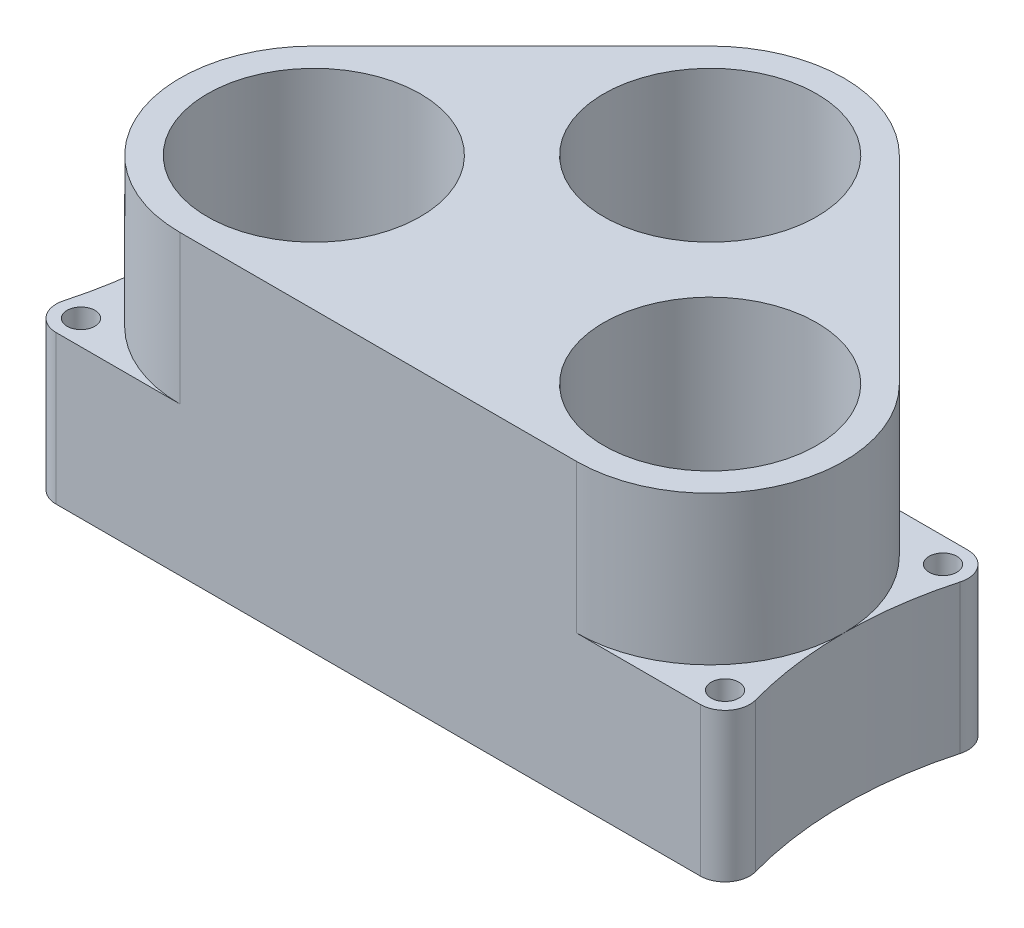
from build123d import *

# Parameters (mm, degrees)
SKETCH1_R           = 27.305
BOSS_EXTRUDE1_DEPTH = 76.2
SKETCH1_3_R         = 3.556
BOSS_EXTRUDE2_DEPTH = 38.1


with BuildPart() as part:
    # Sketch1 → Boss-Extrude1 (new body)
    with BuildSketch(Plane(origin=(0, 0, 0), x_dir=(1, 0, 0), z_dir=(0, 1, 0))):
        with BuildLine():
            Line((26.553308473, 75.046691527), (-24.246691527, 24.246691527))
            ThreePointArc((-24.246691527, 24.246691527), (-31.67982917, -13.122214896), (0, -34.29))
            Line((0, -34.29), (101.6, -34.29))
            ThreePointArc((101.6, -34.29), (133.27982917, -13.122214896), (125.846691527, 24.246691527))
            Line((125.846691527, 24.246691527), (75.046691527, 75.046691527))
            ThreePointArc((75.046691527, 75.046691527), (50.8, 85.09), (26.553308473, 75.046691527))
        make_face()
        with Locations(Location((101.6, 0, 0), (0, 0, 90))):
            Circle(SKETCH1_R, mode=Mode.SUBTRACT)
        with Locations(Location((0, 0, 0), (0, 0, 90))):
            Circle(SKETCH1_R, mode=Mode.SUBTRACT)
        with Locations(Location((50.8, 50.8, 0), (0, 0, 90))):
            Circle(SKETCH1_R, mode=Mode.SUBTRACT)
    extrude(amount=BOSS_EXTRUDE1_DEPTH)

    # Sketch1<3> → Boss-Extrude2 (add)
    # profile 1 of 4: a face of its own
    with BuildSketch(Plane(origin=(0, 0, 0), x_dir=(1, 0, 0), z_dir=(0, 1, 0))):
        with BuildLine():
            Line((-24.246691527, 24.246691527), (-14.203383054, 34.29))
            Line((-14.203383054, 34.29), (-31.75, 34.29))
            ThreePointArc((-31.75, 34.29), (-36.805629933, 31.782278749), (-37.868154158, 26.23979716))
            ThreePointArc((-37.868154158, 26.23979716), (-35.188658815, 13.241319251), (-34.29, -3e-09))
            ThreePointArc((-34.29, -3e-09), (-31.67982917, 13.122214895), (-24.246691527, 24.246691527))
        make_face()
        with Locations(Location((-31.75, 27.94, 0), (0, 0, 90))):
            Circle(SKETCH1_3_R, mode=Mode.SUBTRACT)
    # profile 2 of 4: a face of its own
    with BuildSketch(Plane(origin=(0, 0, 0), x_dir=(1, 0, 0), z_dir=(0, 1, 0))):
        with BuildLine():
            ThreePointArc((0, -34.29), (-24.246691526, -24.246691528), (-34.29, -3e-09))
            ThreePointArc((-34.29, -3e-09), (-35.188658815, -13.241319254), (-37.868154158, -26.23979716))
            ThreePointArc((-37.868154158, -26.23979716), (-36.805629933, -31.782278749), (-31.75, -34.29))
            Line((-31.75, -34.29), (0, -34.29))
        make_face()
        with Locations(Location((-31.75, -27.94, 0), (0, 0, 90))):
            Circle(SKETCH1_3_R, mode=Mode.SUBTRACT)
    # profile 3 of 4: a face of its own
    with BuildSketch(Plane(origin=(0, 0, 0), x_dir=(1, 0, 0), z_dir=(0, 1, 0))):
        with BuildLine():
            Line((133.35, 34.29), (115.803383054, 34.29))
            Line((115.803383054, 34.29), (125.846691527, 24.246691527))
            ThreePointArc((125.846691527, 24.246691527), (133.279829151, 13.122214941), (135.89, 9.8e-08))
            ThreePointArc((135.89, 9.8e-08), (136.788658821, 13.241319301), (139.468154158, 26.23979716))
            ThreePointArc((139.468154158, 26.23979716), (138.405629933, 31.782278749), (133.35, 34.29))
        make_face()
        with Locations(Location((133.35, 27.94, 0), (0, 0, 90))):
            Circle(SKETCH1_3_R, mode=Mode.SUBTRACT)
    # profile 4 of 4: a face of its own
    with BuildSketch(Plane(origin=(0, 0, 0), x_dir=(1, 0, 0), z_dir=(0, 1, 0))):
        with BuildLine():
            ThreePointArc((135.89, 9.8e-08), (125.846691562, -24.246691492), (101.6, -34.29))
            Line((101.6, -34.29), (133.35, -34.29))
            ThreePointArc((133.35, -34.29), (138.405629933, -31.782278749), (139.468154158, -26.23979716))
            ThreePointArc((139.468154158, -26.23979716), (136.788658808, -13.241319204), (135.89, 9.8e-08))
        make_face()
        with Locations(Location((133.35, -27.94, 0), (0, 0, 90))):
            Circle(SKETCH1_3_R, mode=Mode.SUBTRACT)
    extrude(amount=BOSS_EXTRUDE2_DEPTH)


solid = part.part
